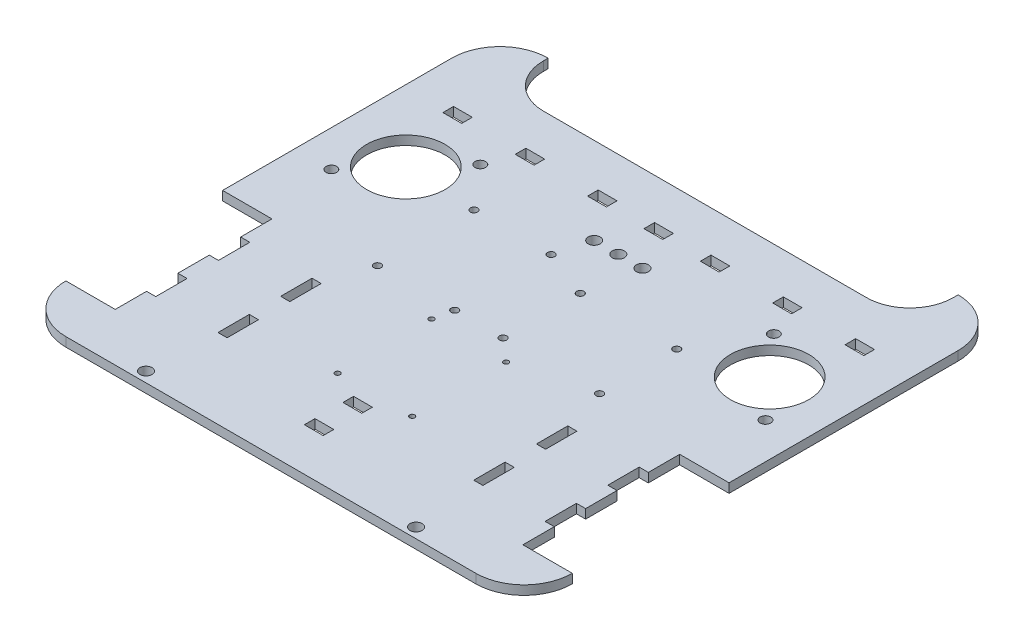
from build123d import *

# Parameters (mm, degrees)
SKETCH1_W           = 266.7
SKETCH1_H           = 254
BOSS_EXTRUDE1_DEPTH = 4.826
SKETCH2_W           = 26.00000007
SKETCH2_H           = 82.55
CUT_EXTRUDE1_DEPTH  = 4.826
CUT_EXTRUDE3_DEPTH  = 4.826
SKETCH7_W           = 215.9
SKETCH7_H           = 25.4
CUT_EXTRUDE5_DEPTH  = 4.826
FILLET9_R           = 22.86
FILLET10_R          = 22.86
CUT_EXTRUDE6_DEPTH  = 4.826
SKETCH9_R           = 3.175
CUT_EXTRUDE7_DEPTH  = 4.826
SKETCH10_W          = 4.826
SKETCH10_H          = 16.51
CUT_EXTRUDE8_DEPTH  = 185.213226387
SKETCH12_W          = 4.826
SKETCH12_H          = 16.51
CUT_EXTRUDE9_DEPTH  = 185.213226387
SKETCH13_W          = 4.826
SKETCH13_H          = 16.51
CUT_EXTRUDE10_DEPTH = 185.213226387
SKETCH15_R          = 1.3462
CUT_EXTRUDE11_DEPTH = 185.213226387
SKETCH16_R          = 2.778125
SKETCH16_R_2        = 20.6375
CUT_EXTRUDE12_DEPTH = 185.213226387
SKETCH17_W          = 9.906
SKETCH17_H          = 5.588
CUT_EXTRUDE13_DEPTH = 185.213226387
SKETCH18_W          = 9.906
SKETCH18_H          = 5.588
CUT_EXTRUDE14_DEPTH = 185.213226387
SKETCH19_R          = 3.175
CUT_EXTRUDE15_DEPTH = 185.213226387
SKETCH20_R          = 1.905
CUT_EXTRUDE16_DEPTH = 185.213226387
SKETCH21_R          = 1.905
CUT_EXTRUDE17_DEPTH = 185.213226387


with BuildPart() as part:
    # Sketch1 → Boss-Extrude1 (new body)
    with BuildSketch(Plane(origin=(0, 0, 0), x_dir=(1, 0, 0), z_dir=(0, 1, 0))):
        Rectangle(SKETCH1_W, SKETCH1_H)
    extrude(amount=BOSS_EXTRUDE1_DEPTH)

    # Sketch2 → Cut-Extrude1 (cut)
    with BuildSketch(Plane(origin=(0, 4.826, 0), x_dir=(1, 0, 0), z_dir=(0, 1, 0))):
        with Locations((-120.349999965, -60.325)):
            Rectangle(SKETCH2_W, SKETCH2_H)
        with Locations((120.349999965, -60.325)):
            Rectangle(SKETCH2_W, SKETCH2_H)
    extrude(amount=-CUT_EXTRUDE1_DEPTH, mode=Mode.SUBTRACT)

    # Sketch4 → Cut-Extrude3 (cut)
    with BuildSketch(Plane(origin=(0, 4.826, 0), x_dir=(1, 0, 0), z_dir=(0, 1, 0))):
        with BuildLine():
            Line((-133.35, 101.6), (-133.35, 127))
            Line((-133.35, 127), (-107.95, 127))
            ThreePointArc((-107.95, 127), (-125.910512242, 119.560512242), (-133.35, 101.6))
        make_face()
        with BuildLine():
            Line((133.35, 101.6), (133.35, 127))
            Line((133.35, 127), (107.95, 127))
            ThreePointArc((107.95, 127), (125.910512242, 119.560512242), (133.35, 101.6))
        make_face()
    extrude(amount=-CUT_EXTRUDE3_DEPTH, mode=Mode.SUBTRACT)

    # Sketch7 → Cut-Extrude5 (cut)
    with BuildSketch(Plane(origin=(0, 4.826, 0), x_dir=(1, 0, 0), z_dir=(0, 1, 0))):
        with Locations((0, 114.3)):
            Rectangle(SKETCH7_W, SKETCH7_H)
    extrude(amount=-CUT_EXTRUDE5_DEPTH, mode=Mode.SUBTRACT)

    # Fillet9
    fillet9_edges = [part.edges().sort_by_distance(p)[0] for p in [
        (-107.95, 2.413, -101.6),
    ]]
    fillet(fillet9_edges, radius=FILLET9_R)

    # Fillet10
    fillet10_edges = [part.edges().sort_by_distance(p)[0] for p in [
        (107.95, 2.413, -101.6),
    ]]
    fillet(fillet10_edges, radius=FILLET10_R)

    # Sketch8 → Cut-Extrude6 (cut)
    with BuildSketch(Plane(origin=(0, 4.826, 0), x_dir=(1, 0, 0), z_dir=(0, 1, 0))):
        with BuildLine():
            Line((-133.35, -101.6), (-133.35, -127))
            Line((-133.35, -127), (-107.95, -127))
            ThreePointArc((-107.95, -127), (-125.910512242, -119.560512242), (-133.35, -101.6))
        make_face()
        with BuildLine():
            Line((133.35, -127), (107.95, -127))
            ThreePointArc((107.95, -127), (125.910512242, -119.560512242), (133.35, -101.6))
            Line((133.35, -101.6), (133.35, -127))
        make_face()
    extrude(amount=-CUT_EXTRUDE6_DEPTH, mode=Mode.SUBTRACT)

    # Sketch9 → Cut-Extrude7 (cut)
    with BuildSketch(Plane(origin=(0, 4.826, 0), x_dir=(1, 0, 0), z_dir=(0, 1, 0))):
        with Locations((-71.12, -121.629004431)):
            Circle(SKETCH9_R)
        with Locations((71.12, -121.629004431)):
            Circle(SKETCH9_R)
    extrude(amount=-CUT_EXTRUDE7_DEPTH, mode=Mode.SUBTRACT)

    # Sketch10 → Cut-Extrude8 (cut, through all)
    with BuildSketch(Plane(origin=(0, 4.826, 0), x_dir=(1, 0, 0), z_dir=(0, 1, 0))):
        with Locations((-104.93699993, -76.835)):
            Rectangle(SKETCH10_W, SKETCH10_H)
        with Locations((-104.93699993, -43.815)):
            Rectangle(SKETCH10_W, SKETCH10_H)
        with Locations((104.93699993, -43.815)):
            Rectangle(SKETCH10_W, SKETCH10_H)
        with Locations((104.93699993, -76.835)):
            Rectangle(SKETCH10_W, SKETCH10_H)
    extrude(amount=-CUT_EXTRUDE8_DEPTH, mode=Mode.SUBTRACT)

    # Sketch12 → Cut-Extrude9 (cut, through all)
    with BuildSketch(Plane.XZ):
        with Locations((-67.34499993, 76.835)):
            Rectangle(SKETCH12_W, SKETCH12_H)
        with Locations((-67.34499993, 43.815)):
            Rectangle(SKETCH12_W, SKETCH12_H)
    extrude(amount=-CUT_EXTRUDE9_DEPTH, mode=Mode.SUBTRACT)

    # Sketch13 → Cut-Extrude10 (cut, through all)
    with BuildSketch(Plane(origin=(0, 4.826, 0), x_dir=(1, 0, 0), z_dir=(0, 1, 0))):
        with Locations((67.34499993, -76.835)):
            Rectangle(SKETCH13_W, SKETCH13_H)
        with Locations((67.34499993, -43.815)):
            Rectangle(SKETCH13_W, SKETCH13_H)
    extrude(amount=-CUT_EXTRUDE10_DEPTH, mode=Mode.SUBTRACT)

    # Sketch15 → Cut-Extrude11 (cut, through all)
    with BuildSketch(Plane(origin=(0, 4.826, 0), x_dir=(1, 0, 0), z_dir=(0, 1, 0))):
        with Locations((19.5961, -22.730838906)):
            Circle(SKETCH15_R)
        with Locations((-19.6723, -22.730838906)):
            Circle(SKETCH15_R)
        with Locations((-19.6723, -72.163561094)):
            Circle(SKETCH15_R)
        with Locations((19.5961, -72.163561094)):
            Circle(SKETCH15_R)
    extrude(amount=-CUT_EXTRUDE11_DEPTH, mode=Mode.SUBTRACT)

    # Sketch16 → Cut-Extrude12 (cut, through all)
    with BuildSketch(Plane(origin=(0, 4.826, 0), x_dir=(1, 0, 0), z_dir=(0, 1, 0))):
        with Locations((77.293854564, 60.610218612)):
            Circle(SKETCH16_R)
        with Locations((114.3, 19.164632523)):
            Circle(SKETCH16_R)
        with Locations((95.796927282, 39.887425568)):
            Circle(SKETCH16_R_2)
        with Locations((-95.796927282, 39.887425568)):
            Circle(SKETCH16_R_2)
        with Locations((-77.293854564, 60.610218612)):
            Circle(SKETCH16_R)
        with Locations((-114.3, 19.164632523)):
            Circle(SKETCH16_R)
    extrude(amount=-CUT_EXTRUDE12_DEPTH, mode=Mode.SUBTRACT)

    # Sketch17 → Cut-Extrude13 (cut, through all)
    with BuildSketch(Plane(origin=(0, 4.826, 0), x_dir=(1, 0, 0), z_dir=(0, 1, 0))):
        with Locations((-67.795869789, 77.244822677)):
            Rectangle(SKETCH17_W, SKETCH17_H)
        with Locations((-105.895869789, 77.244822677)):
            Rectangle(SKETCH17_W, SKETCH17_H)
        with Locations((-29.695869789, 77.244822677)):
            Rectangle(SKETCH17_W, SKETCH17_H)
        with Locations((0, 77.244822677)):
            Rectangle(SKETCH17_W, SKETCH17_H)
        with Locations((29.695869789, 77.244822677)):
            Rectangle(SKETCH17_W, SKETCH17_H)
        with Locations((67.795869789, 77.244822677)):
            Rectangle(SKETCH17_W, SKETCH17_H)
        with Locations((105.895869789, 77.244822677)):
            Rectangle(SKETCH17_W, SKETCH17_H)
    extrude(amount=-CUT_EXTRUDE13_DEPTH, mode=Mode.SUBTRACT)

    # Sketch18 → Cut-Extrude14 (cut, through all)
    with BuildSketch(Plane(origin=(0, 4.826, 0), x_dir=(1, 0, 0), z_dir=(0, 1, 0))):
        with Locations((0, -101.6)):
            Rectangle(SKETCH18_W, SKETCH18_H)
        with Locations((0, -81.28)):
            Rectangle(SKETCH18_W, SKETCH18_H)
    extrude(amount=-CUT_EXTRUDE14_DEPTH, mode=Mode.SUBTRACT)

    # Sketch19 → Cut-Extrude15 (cut, through all)
    with BuildSketch(Plane(origin=(0, 4.826, 0), x_dir=(1, 0, 0), z_dir=(0, 1, 0))):
        with Locations((0, 55.982011538)):
            Circle(SKETCH19_R)
        with Locations((12.7, 55.982011538)):
            Circle(SKETCH19_R)
        with Locations((-12.7, 55.982011538)):
            Circle(SKETCH19_R)
    extrude(amount=-CUT_EXTRUDE15_DEPTH, mode=Mode.SUBTRACT)

    # Sketch20 → Cut-Extrude16 (cut, through all)
    with BuildSketch(Plane(origin=(0, 4.826, 0), x_dir=(1, 0, 0), z_dir=(0, 1, 0))):
        with Locations((-58.243854564, 38.202011538)):
            Circle(SKETCH20_R)
        with Locations((-17.603854564, 38.202011538)):
            Circle(SKETCH20_R)
        with Locations((-58.243854564, -12.597988462)):
            Circle(SKETCH20_R)
        with Locations((-17.603854564, -12.597988462)):
            Circle(SKETCH20_R)
    extrude(amount=-CUT_EXTRUDE16_DEPTH, mode=Mode.SUBTRACT)

    # Sketch21 → Cut-Extrude17 (cut, through all)
    with BuildSketch(Plane(origin=(0, 4.826, 0), x_dir=(1, 0, 0), z_dir=(0, 1, 0))):
        with Locations((7.796145436, 28.154731738)):
            Circle(SKETCH21_R)
        with Locations((58.596145436, 28.154731738)):
            Circle(SKETCH21_R)
        with Locations((7.796145436, -12.485268262)):
            Circle(SKETCH21_R)
        with Locations((58.596145436, -12.485268262)):
            Circle(SKETCH21_R)
    extrude(amount=-CUT_EXTRUDE17_DEPTH, mode=Mode.SUBTRACT)


solid = part.part
